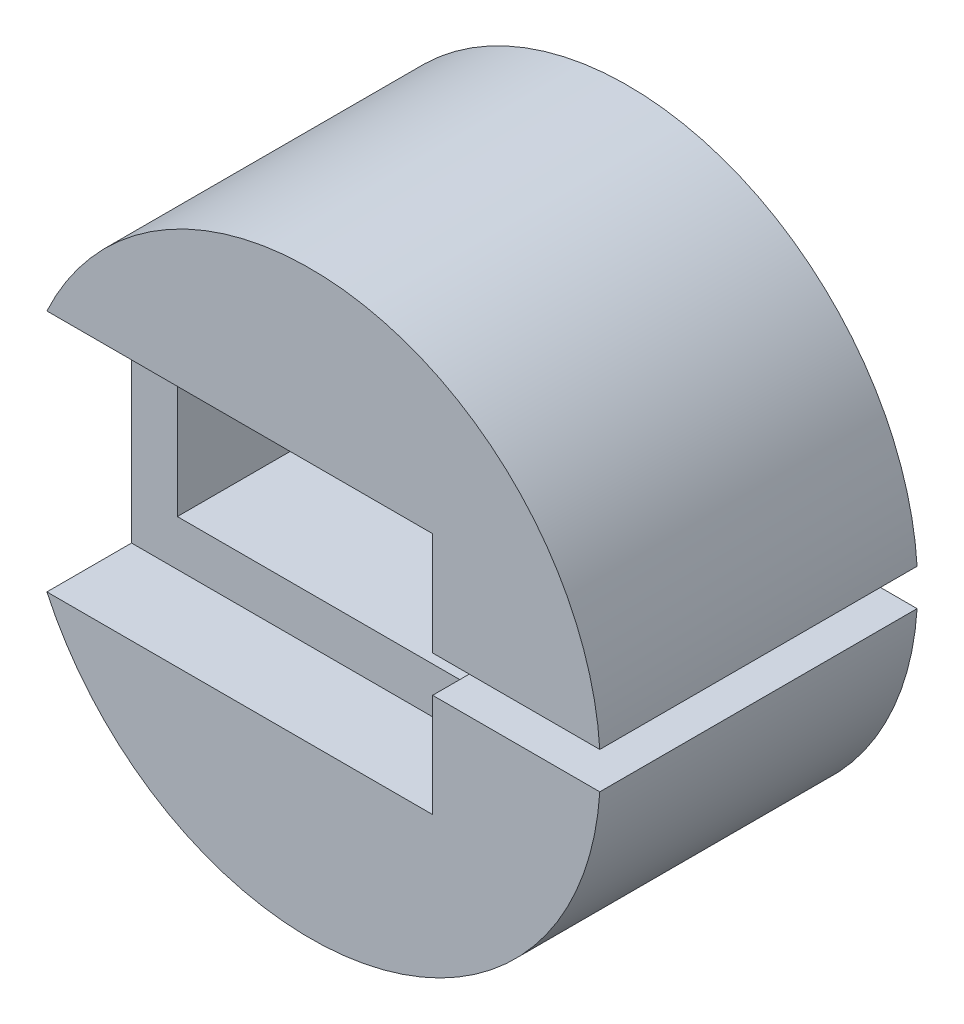
from build123d import *

# Parameters (mm, degrees)
BOSS_EXTRUDE1_DEPTH = 28
BOSS_EXTRUDE2_DEPTH = 5
BOSS_EXTRUDE6_START = 40
BOSS_EXTRUDE6_DEPTH = 40


with BuildPart() as part:
    # Sketch1 → Boss-Extrude1 (new body)
    with BuildSketch(Plane.XY):
        Polygon((10.849101299, 4.6), (12.849101299, 2.6), (17.349101299, 2.6), (17.349101299, 17.249101299), (-37.349101299, 17.249101299), (-37.349101299, -17.249101299), (17.349101299, -17.249101299), (17.349101299, -2.6), (12.849101299, -2.6), (10.849101299, -4.6), (10.849101299, -10.749101299), (-30.849101299, -10.749101299), (-30.849101299, 10.749101299), (10.849101299, 10.749101299), align=None)
    extrude(amount=-BOSS_EXTRUDE1_DEPTH)

    # Sketch2 → Boss-Extrude2 (add)
    with BuildSketch(Plane(origin=(0, 0, -28), x_dir=(-1, 0, 0), z_dir=(0, 0, -1))):
        with BuildLine():
            Line((-12.849101299, 2.6), (-41.057604209, 2.6))
            ThreePointArc((-41.057604209, 2.6), (41.139845204, 0), (-41.057604209, -2.6))
            Line((-41.057604209, -2.6), (-12.849101299, -2.6))
            Line((-12.849101299, -2.6), (-12.849101299, 2.6))
        make_face()
    extrude(amount=BOSS_EXTRUDE2_DEPTH)

    # Sketch3 → Boss-Extrude6 (add)
    with BuildSketch(Plane.XY.offset(-28).offset(BOSS_EXTRUDE6_START)):
        with BuildLine():
            Line((-37.349101299, 17.249101299), (17.349101299, 17.249101299))
            Line((17.349101299, 17.249101299), (17.349101299, 2.6))
            Line((17.349101299, 2.6), (41.057604209, 2.6))
            ThreePointArc((41.057604209, 2.6), (7.55561319, 40.440073847), (-37.349101299, 17.249101299))
        make_face()
        with BuildLine():
            Line((41.057604209, -2.6), (17.349101299, -2.6))
            Line((17.349101299, -2.6), (17.349101299, -17.249101299))
            Line((17.349101299, -17.249101299), (-37.349101299, -17.249101299))
            ThreePointArc((-37.349101299, -17.249101299), (7.55561319, -40.440073847), (41.057604209, -2.6))
        make_face()
    extrude(amount=-BOSS_EXTRUDE6_DEPTH)


solid = part.part
